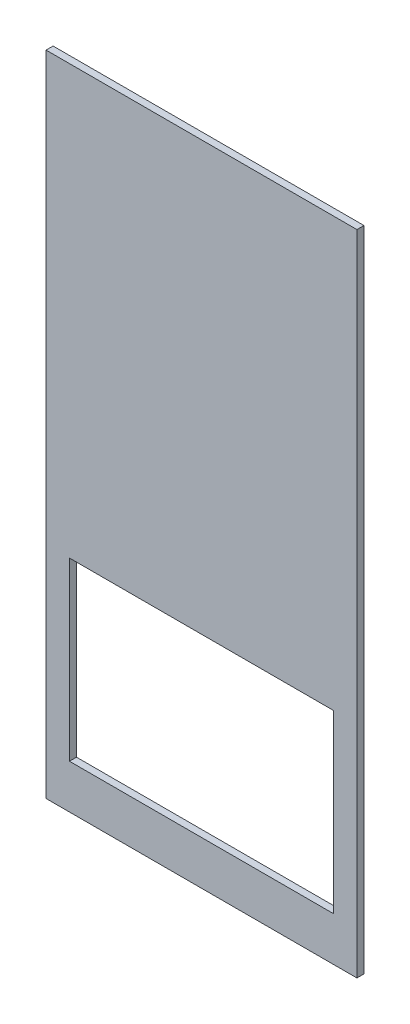
from build123d import *

# Parameters (mm, degrees)
ESBO_O1_W                = 265
ESBO_O1_H                = 552.5
ESBO_O1_W_2              = 225
ESBO_O1_H_2              = 150
RESSALTO_EXTRUS_O1_DEPTH = 6


with BuildPart() as part:
    # Esboço1 → Ressalto-extrusão1 (new body)
    with BuildSketch(Plane.XY):
        with Locations((132.5, 276.25)):
            Rectangle(ESBO_O1_W, ESBO_O1_H)
        with Locations((132.5, 112.5)):
            Rectangle(ESBO_O1_W_2, ESBO_O1_H_2, mode=Mode.SUBTRACT)
    extrude(amount=RESSALTO_EXTRUS_O1_DEPTH)


solid = part.part
